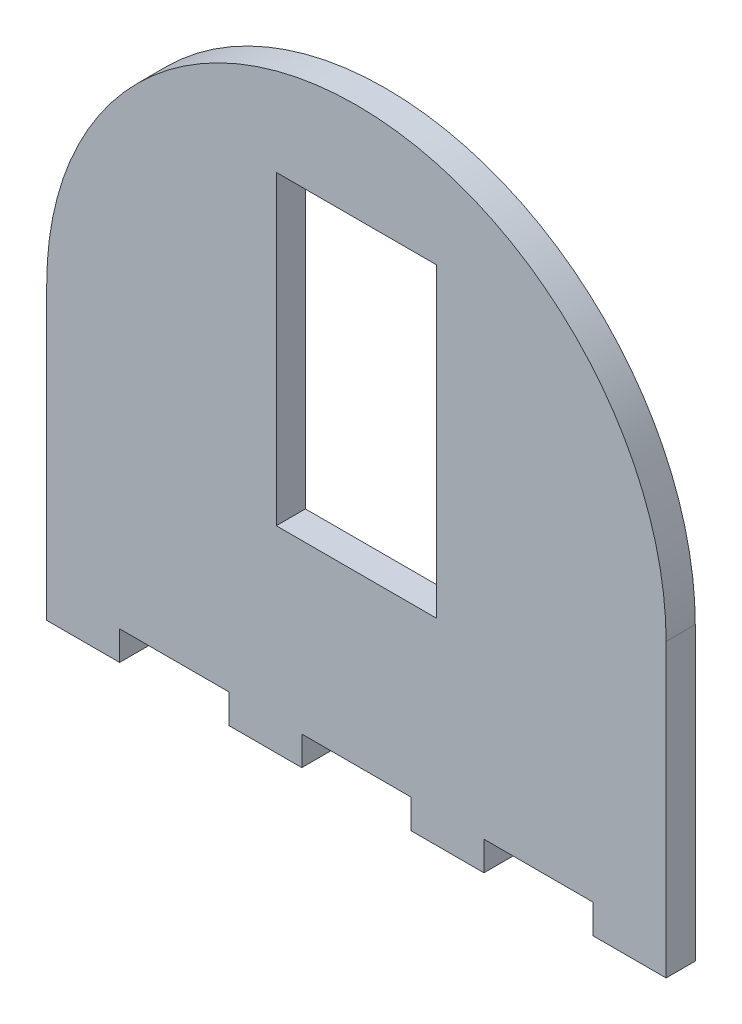
from build123d import *

# Parameters (mm, degrees)
SALIENTE_EXTRUIR1_DEPTH = 4
CROQUIS2_W              = 22
CROQUIS2_H              = 42
CORTAR_EXTRUIR1_DEPTH   = 4


with BuildPart() as part:
    # Croquis1 → Saliente-Extruir1 (new body)
    with BuildSketch(Plane.XY):
        with BuildLine():
            Line((0, 0), (10, 0))
            Line((10, 0), (10, 4))
            Line((10, 4), (25, 4))
            Line((25, 4), (25, 0))
            Line((25, 0), (35, 0))
            Line((35, 0), (35, 4))
            Line((35, 4), (50, 4))
            Line((50, 4), (50, 0))
            Line((50, 0), (60, 0))
            Line((60, 0), (60, 4))
            Line((60, 4), (75, 4))
            Line((75, 4), (75, 0))
            Line((75, 0), (85, 0))
            Line((85, 0), (85, 40))
            ThreePointArc((85, 40), (42.5, 82.5), (0, 40))
            Line((0, 40), (0, 0))
        make_face()
    extrude(amount=SALIENTE_EXTRUIR1_DEPTH)

    # Croquis2 → Cortar-Extruir1 (cut)
    with BuildSketch(Plane.XY.offset(4)):
        with Locations((42.5, 48)):
            Rectangle(CROQUIS2_W, CROQUIS2_H)
    extrude(amount=-CORTAR_EXTRUIR1_DEPTH, mode=Mode.SUBTRACT)


solid = part.part
